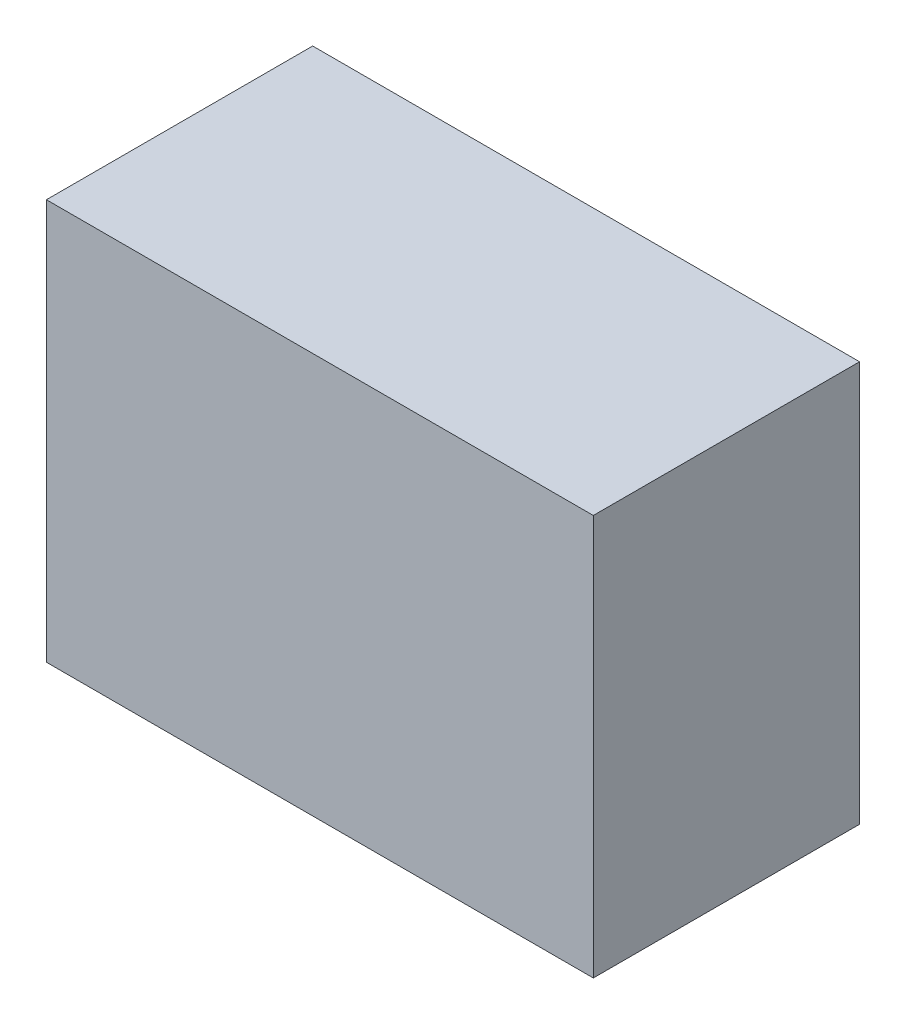
from build123d import *

# Parameters (mm, degrees)
SKETCH3_W           = 45.6
SKETCH3_H           = 33.4
BOSS_EXTRUDE1_DEPTH = 22.2


with BuildPart() as part:
    # Sketch3 → Boss-Extrude1 (new body)
    with BuildSketch(Plane.XY):
        with Locations((22.8, 16.7)):
            Rectangle(SKETCH3_W, SKETCH3_H)
    extrude(amount=BOSS_EXTRUDE1_DEPTH)


solid = part.part
